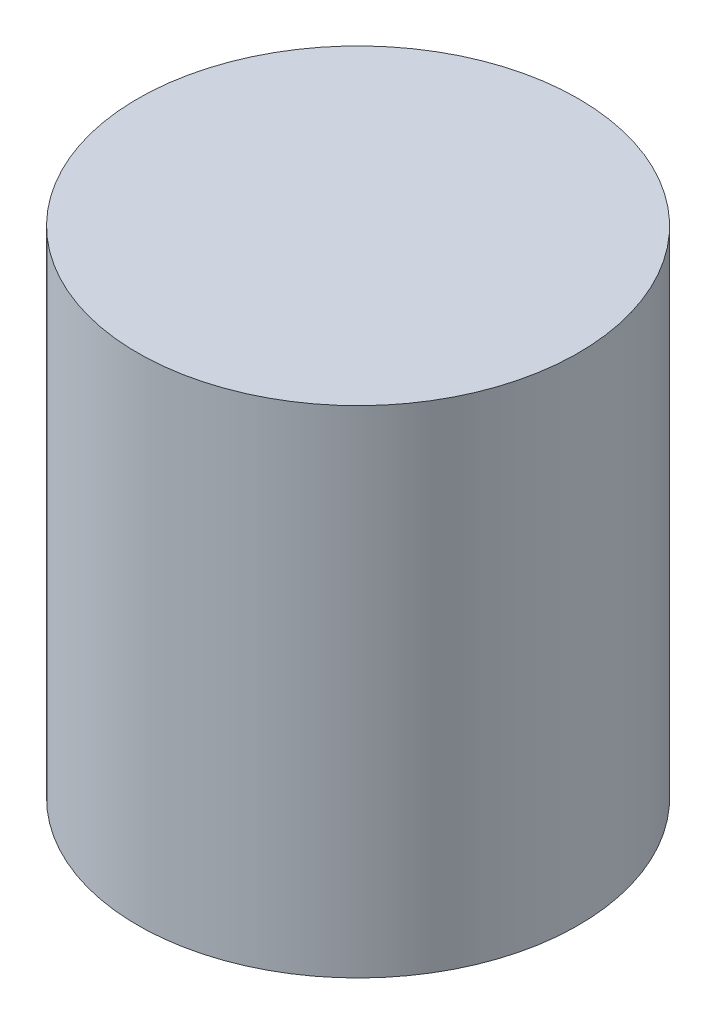
from build123d import *

# Parameters (mm, degrees)
SKETCH2_R           = 20
BOSS_EXTRUDE1_DEPTH = 45


with BuildPart() as part:
    # Sketch2 → Boss-Extrude1 (new body)
    with BuildSketch(Plane(origin=(0, 0, 0), x_dir=(1, 0, 0), z_dir=(0, 1, 0))):
        with Locations(Location((0, 0, 0), (0, 0, 90))):
            Circle(SKETCH2_R)
    extrude(amount=BOSS_EXTRUDE1_DEPTH)


solid = part.part
